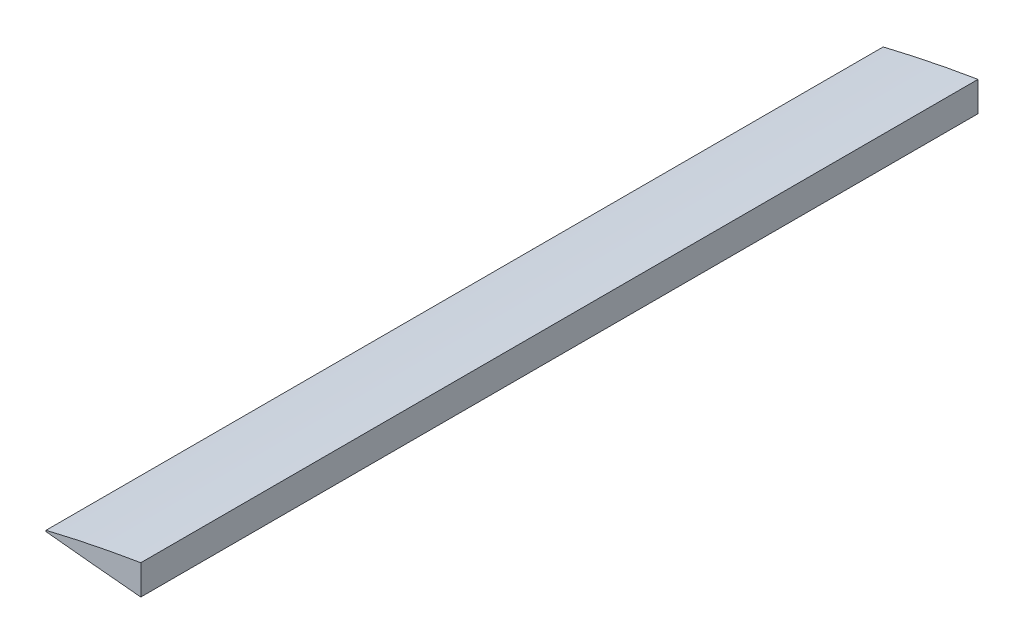
from build123d import *

# Parameters (mm, degrees)
BOSS_EXTRUDE1_DEPTH = 612
SKETCH2_W           = 21
SKETCH2_H           = 11.5
CUT_EXTRUDE1_DEPTH  = 13


with BuildPart() as part:
    # Sketch1 → Boss-Extrude1 (new body)
    with BuildSketch(Plane.XY):
        with BuildLine():
            Line((-197.26698, 14.545556384), (-197.26698, -7.208910553))
            add(Edge.make_bspline(
                [(-197.26698, -7.208910553), (-199.019685082, -7.050017591), (-203.678439199, -6.627674295), (-211.084107985, -5.939566862), (-219.309277242, -5.164758413), (-227.009246775, -4.426989792), (-234.135070336, -3.733626285), (-240.641108589, -3.09072516), (-246.485492991, -2.504721762), (-251.630355083, -1.980998363), (-256.042317783, -1.527359301), (-259.692220923, -1.143575744), (-262.556904408, -0.849913683), (-264.61546863, -0.612861211), (-265.858416096, -0.512805201), (-266.419029816, -0.418366575), (-266.567688701, -0.418895711), (-266.577, -0.418928854)],
                knots=[0, 0, 0, 0, 0.075810952, 0.201508279, 0.320388141, 0.43169539, 0.534719075, 0.628797147, 0.713321079, 0.787740393, 0.851567051, 0.904379655, 0.945827345, 0.975633259, 0.993597432, 0.999598973, 1, 1, 1, 1], degree=3))
            Line((-266.577, -0.418928854), (-266.577, 0.425749675))
            add(Edge.make_bspline(
                [(-197.26698, 14.545556384), (-199.291263309, 14.209823561), (-204.216747599, 13.392918764), (-211.867868306, 12.029944562), (-220.046716751, 10.510857765), (-227.684960434, 9.024190881), (-234.737637437, 7.595336861), (-241.162806841, 6.244958614), (-246.922671776, 4.994209984), (-251.983535287, 3.863074945), (-256.315994171, 2.870269339), (-259.895031115, 2.032695679), (-262.700108493, 1.365039117), (-264.715189951, 0.879184388), (-265.919534871, 0.586380331), (-266.450919413, 0.456553449), (-266.577, 0.425749675)],
                knots=[0, 0, 0, 0, 0.087007005, 0.211705365, 0.329527113, 0.439740645, 0.541660709, 0.634652346, 0.718134669, 0.791584505, 0.854539888, 0.906603358, 0.947445002, 0.976805146, 0.994496602, 1, 1, 1, 1], degree=3))
        make_face()
    extrude(amount=BOSS_EXTRUDE1_DEPTH)

    # Sketch2 → Cut-Extrude1 (cut)
    with BuildSketch(Plane.XY.offset(83.9)):
        with Locations((-209.932, -2.027)):
            Rectangle(SKETCH2_W, SKETCH2_H)
    extrude(amount=CUT_EXTRUDE1_DEPTH, mode=Mode.SUBTRACT)


solid = part.part
